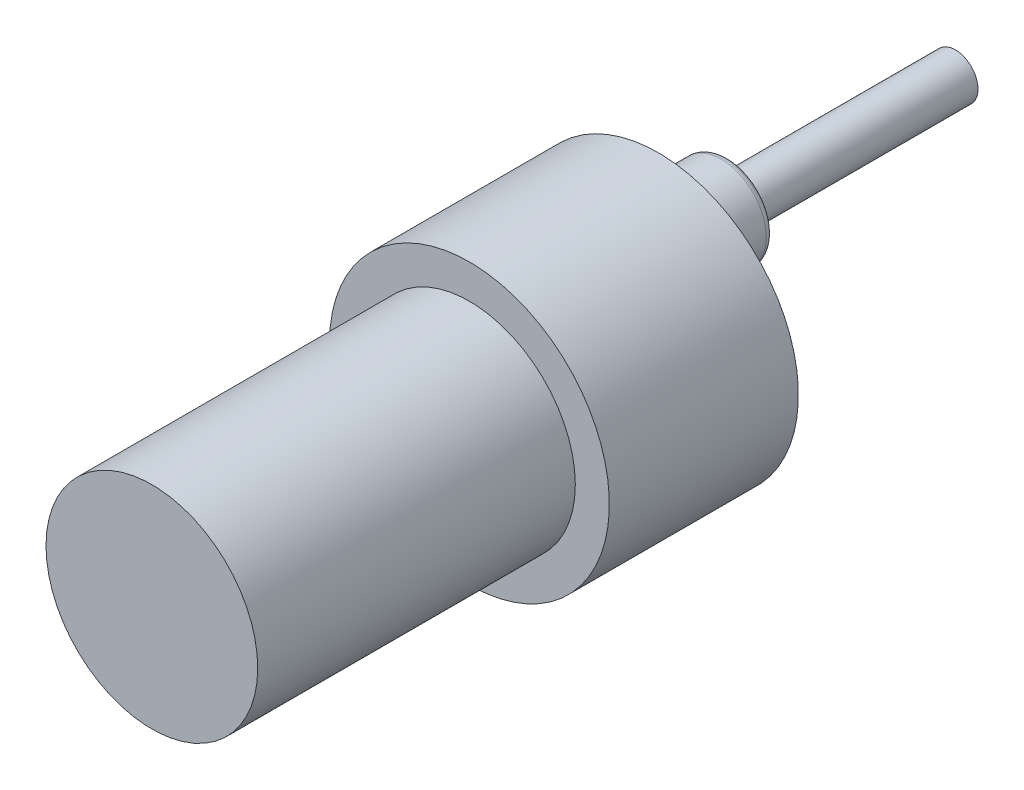
from build123d import *

# Parameters (mm, degrees)
SKETCH1_W           = 18.5
SKETCH1_H           = 25
SKETCH2_R           = 14
BOSS_EXTRUDE1_DEPTH = 42
FILLET1_R           = 1


with BuildPart() as part:
    # Sketch1 → Revolve1 (revolve)
    with BuildSketch(Plane.XZ, mode=Mode.PRIVATE) as revolve1_sk:
        with Locations((9.25, -12.5)):
            Rectangle(SKETCH1_W, SKETCH1_H)
    revolve(revolve1_sk.sketch.rotate(Axis((0, 0, 0), (0, 0, -1)), 180), axis=Axis((0, 0, 0), (0, 0, -1)))

    # Sketch2 → Boss-Extrude1 (add)
    with BuildSketch(Plane.XY):
        with Locations(Location((0, 0, 0), (0, 0, 180))):
            Circle(SKETCH2_R)
    extrude(amount=BOSS_EXTRUDE1_DEPTH)

    # Sketch3 → Revolve2 (revolve)
    with BuildSketch(Plane.XZ.offset(-7.419045711), mode=Mode.PRIVATE) as revolve2_sk:
        Polygon((5.757740364, -25), (-0.242259636, -25), (-0.242259636, -64.5), (2.757740364, -64.5), (2.757740364, -34.5), (5.757740364, -34.5), align=None)
    revolve(revolve2_sk.sketch.rotate(Axis((-0.242259636, 7.419045711, -25), (0, 0, -1)), 180), axis=Axis((-0.242259636, 7.419045711, -25), (0, 0, -1)))

    # Fillet1
    fillet1_edges = [part.edges().sort_by_distance(p)[0] for p in [
        (5.757740364, 7.419045711, -34.5),
    ]]
    fillet(fillet1_edges, radius=FILLET1_R)


solid = part.part
